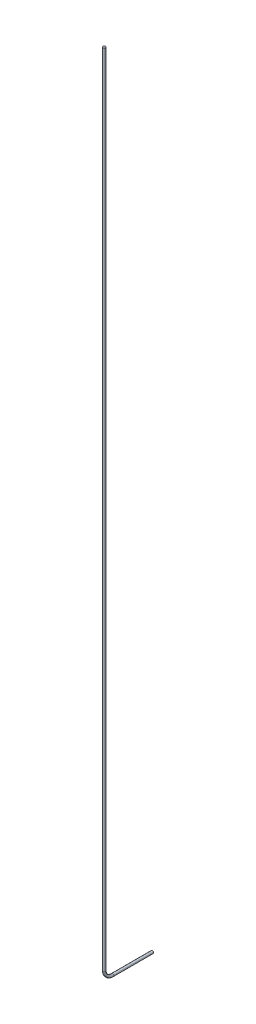
from build123d import *

# Parameters (mm, degrees)
SKETCH_1_R      = 0.8
EXTRUDE_1_DEPTH = 20
SKETCH_2_R      = 0.8


with BuildPart() as part:
    # ｽｹｯﾁ1 → ﾎﾞｽ - 押し出し1 (new body)
    with BuildSketch(Plane.XY):
        Circle(SKETCH_1_R)
    extrude(amount=EXTRUDE_1_DEPTH)

    # ｽｲｰﾌﾟ1: sweep along a path in ｽｹｯﾁ3
    with BuildLine(Plane(origin=(0, 0, 0), x_dir=(0, 0, -1), z_dir=(1, 0, 0))) as sweep_1_path:
        Line((-20, 0), (-25, 0))
        ThreePointArc((-25, 0), (-28.535533906, 1.464466094), (-30, 5))
        Line((-30, 5), (-30, 505))
    # ｽｹｯﾁ2 → ｽｲｰﾌﾟ1 (sweep)
    with BuildSketch(Plane.XY.offset(20)):
        Circle(SKETCH_2_R)
    sweep(path=sweep_1_path.line)


solid = part.part
